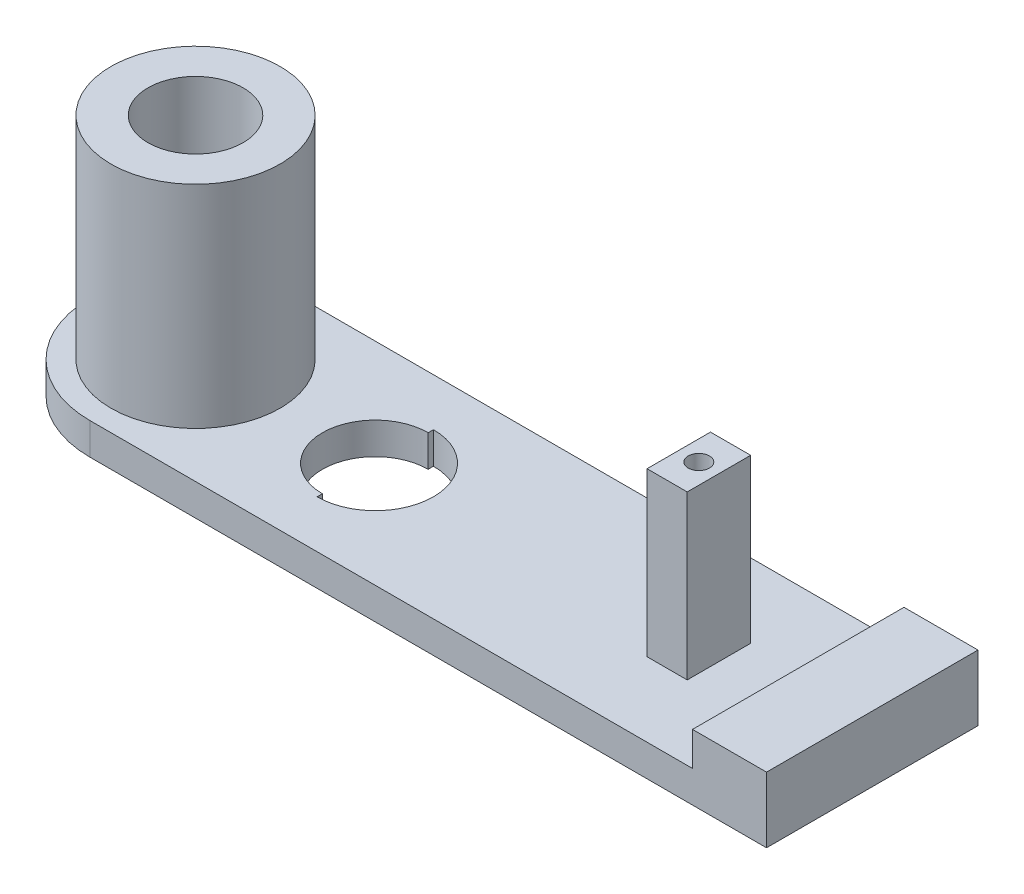
from build123d import *

# Parameters (mm, degrees)
BOSS_EXTRUDE1_DEPTH          = 15
SKETCH3_R                    = 40
BOSS_EXTRUDE2_DEPTH          = 100
TAP_DRILL_FOR_M30X2_0_TAP1_D = 28
SKETCH5_R                    = 22.5
CUT_EXTRUDE1_DEPTH           = 50
SKETCH6_W                    = 35
SKETCH6_H                    = 100
BOSS_EXTRUDE3_DEPTH          = 16
SKETCH7_R                    = 15
CUT_EXTRUDE2_DEPTH           = 238.907545067
SKETCH8_W                    = 19
SKETCH8_H                    = 30
SKETCH8_R                    = 5
BOSS_EXTRUDE4_DEPTH          = 77
CUT_EXTRUDE3_DEPTH           = 238.907545067
SKETCH10_R                   = 5
CUT_EXTRUDE4_DEPTH           = 238.907545067
FILLET1_R                    = 1


with BuildPart() as part:
    # Sketch2 → Boss-Extrude1 (new body)
    with BuildSketch(Plane(origin=(0, 0, 0), x_dir=(1, 0, 0), z_dir=(0, 1, 0))):
        with BuildLine():
            Line((-160, 50), (160, 50))
            Line((160, 50), (160, -50))
            Line((160, -50), (-160, -50))
            ThreePointArc((-160, -50), (-210, 0), (-160, 50))
        make_face()
    extrude(amount=BOSS_EXTRUDE1_DEPTH)

    # Sketch3 → Boss-Extrude2 (add)
    with BuildSketch(Plane(origin=(0, 15, 0), x_dir=(1, 0, 0), z_dir=(0, 1, 0))):
        with Locations(Location((-160, 0, 0), (0, 0, 270))):
            Circle(SKETCH3_R)
    extrude(amount=BOSS_EXTRUDE2_DEPTH)

    # Tap Drill for M30x2.0 Tap1 (through all)
    with Locations(Plane(origin=(-160, 115, 0), x_dir=(0, 0, 1), z_dir=(0, 1, 0))):
        with Locations((0, 0)):
            Hole(TAP_DRILL_FOR_M30X2_0_TAP1_D / 2)

    # Sketch5 → Cut-Extrude1 (cut)
    with BuildSketch(Plane(origin=(0, 115, 0), x_dir=(1, 0, 0), z_dir=(0, 1, 0))):
        with Locations(Location((-160, 0, 0), (0, 0, 270))):
            Circle(SKETCH5_R)
    extrude(amount=-CUT_EXTRUDE1_DEPTH, mode=Mode.SUBTRACT)

    # Sketch6 → Boss-Extrude3 (add)
    with BuildSketch(Plane(origin=(0, 15, 0), x_dir=(1, 0, 0), z_dir=(0, 1, 0))):
        with Locations((142.5, 0)):
            Rectangle(SKETCH6_W, SKETCH6_H)
    extrude(amount=BOSS_EXTRUDE3_DEPTH)

    # Sketch7 → Cut-Extrude2 (cut, through all)
    with BuildSketch(Plane(origin=(0, 15, 0), x_dir=(1, 0, 0), z_dir=(0, 1, 0))):
        with Locations(Location((-75, 0, 0), (0, 0, 270))):
            Circle(SKETCH7_R)
    extrude(amount=-CUT_EXTRUDE2_DEPTH, mode=Mode.SUBTRACT)

    # Sketch8 → Boss-Extrude4 (add)
    with BuildSketch(Plane(origin=(0, 15, 0), x_dir=(1, 0, 0), z_dir=(0, 1, 0))):
        with Locations((78, 0)):
            Rectangle(SKETCH8_W, SKETCH8_H)
        with Locations(Location((78, 0, 0), (0, 0, 270))):
            Circle(SKETCH8_R, mode=Mode.SUBTRACT)
    extrude(amount=BOSS_EXTRUDE4_DEPTH)

    # Sketch9 → Cut-Extrude3 (cut, through all)
    with BuildSketch(Plane(origin=(0, 15, 0), x_dir=(1, 0, 0), z_dir=(0, 1, 0))):
        with BuildLine():
            Line((-75, -27.5), (-75, -25))
            ThreePointArc((-75, -25), (-100, 0), (-75, 25))
            Line((-75, 25), (-75, 27.5))
            ThreePointArc((-75, 27.5), (-47.5, 0), (-75, -27.5))
        make_face()
    extrude(amount=-CUT_EXTRUDE3_DEPTH, mode=Mode.SUBTRACT)

    # Sketch10 → Cut-Extrude4 (cut, through all)
    with BuildSketch(Plane(origin=(0, 15, 0), x_dir=(1, 0, 0), z_dir=(0, 1, 0))):
        with Locations(Location((78, 0, 0), (0, 0, 270))):
            Circle(SKETCH10_R)
    extrude(amount=-CUT_EXTRUDE4_DEPTH, mode=Mode.SUBTRACT)

    # Fillet1
    fillet1_edges = [part.edges().sort_by_distance(p)[0] for p in [
        (-160, 65, -22.5),
    ]]
    fillet(fillet1_edges, radius=FILLET1_R)


solid = part.part
